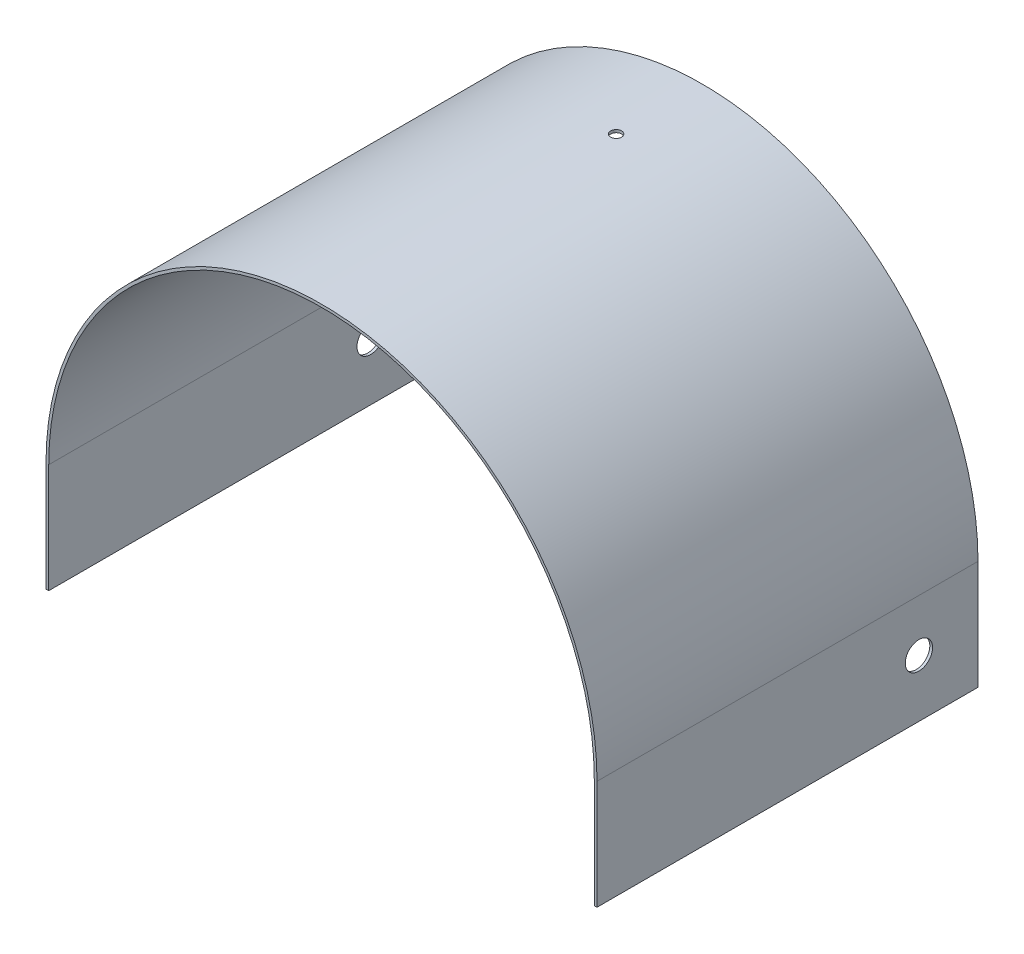
from build123d import *

# Parameters (mm, degrees)
EXTRUDE_2_DEPTH     = 419
SKETCH_2_R          = 6
CUT_EXTRUDE_1_DEPTH = 490
SKETCH_3_R          = 15
CUT_EXTRUDE_2_DEPTH = 500


with BuildPart() as part:
    # 草图1 → 凸台-拉伸2 (new body)
    with BuildSketch(Plane.XY):
        with BuildLine():
            Line((-300, 0), (-300, -120))
            Line((-300, -120), (-303, -120))
            Line((-303, -120), (-303, 0))
            ThreePointArc((-303, 0), (0, 303), (303, 0))
            Line((303, 0), (303, -120))
            Line((303, -120), (300, -120))
            Line((300, -120), (300, 0))
            ThreePointArc((300, 0), (0, 300), (-300, 0))
        make_face()
    extrude(amount=EXTRUDE_2_DEPTH)

    # 草图2 → 切除-拉伸1 (cut)
    with BuildSketch(Plane(origin=(0, 0, 0), x_dir=(1, 0, 0), z_dir=(0, 1, 0))):
        with Locations(Location((0, -95, 0), (0, 0, 90))):
            Circle(SKETCH_2_R)
    extrude(amount=CUT_EXTRUDE_1_DEPTH, mode=Mode.SUBTRACT)

    # 草图3 → 切除-拉伸2 (cut, symmetric)
    with BuildSketch(Plane(origin=(0, 0, 0), x_dir=(0, 0, -1), z_dir=(1, 0, 0))):
        with Locations((-65, -57.08)):
            Circle(SKETCH_3_R)
    extrude(amount=CUT_EXTRUDE_2_DEPTH, both=True, mode=Mode.SUBTRACT)


solid = part.part
